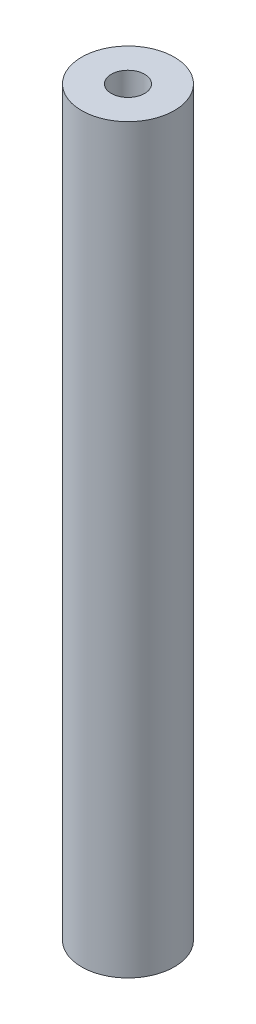
from build123d import *

# Parameters (mm, degrees)
SKETCH1_R           = 5.55625
BOSS_EXTRUDE1_DEPTH = 88.9
SKETCH2_R           = 1.999996
CUT_EXTRUDE1_DEPTH  = 7
SKETCH3_R           = 2
CUT_EXTRUDE2_DEPTH  = 7


with BuildPart() as part:
    # Sketch1 → Boss-Extrude1 (new body)
    with BuildSketch(Plane(origin=(0, 0, 0), x_dir=(1, 0, 0), z_dir=(0, 1, 0))):
        with Locations(Location((0, 0, 0), (0, 0, 270))):
            Circle(SKETCH1_R)
    extrude(amount=BOSS_EXTRUDE1_DEPTH)

    # Sketch2 → Cut-Extrude1 (cut)
    with BuildSketch(Plane(origin=(0, 88.9, 0), x_dir=(1, 0, 0), z_dir=(0, 1, 0))):
        with Locations(Location((0, 0, 0), (0, 0, 270))):
            Circle(SKETCH2_R)
    extrude(amount=-CUT_EXTRUDE1_DEPTH, mode=Mode.SUBTRACT)

    # Sketch3 → Cut-Extrude2 (cut)
    with BuildSketch(Plane.XZ):
        with Locations(Location((0, 0, 0), (0, 0, 270))):
            Circle(SKETCH3_R)
    extrude(amount=-CUT_EXTRUDE2_DEPTH, mode=Mode.SUBTRACT)


solid = part.part
